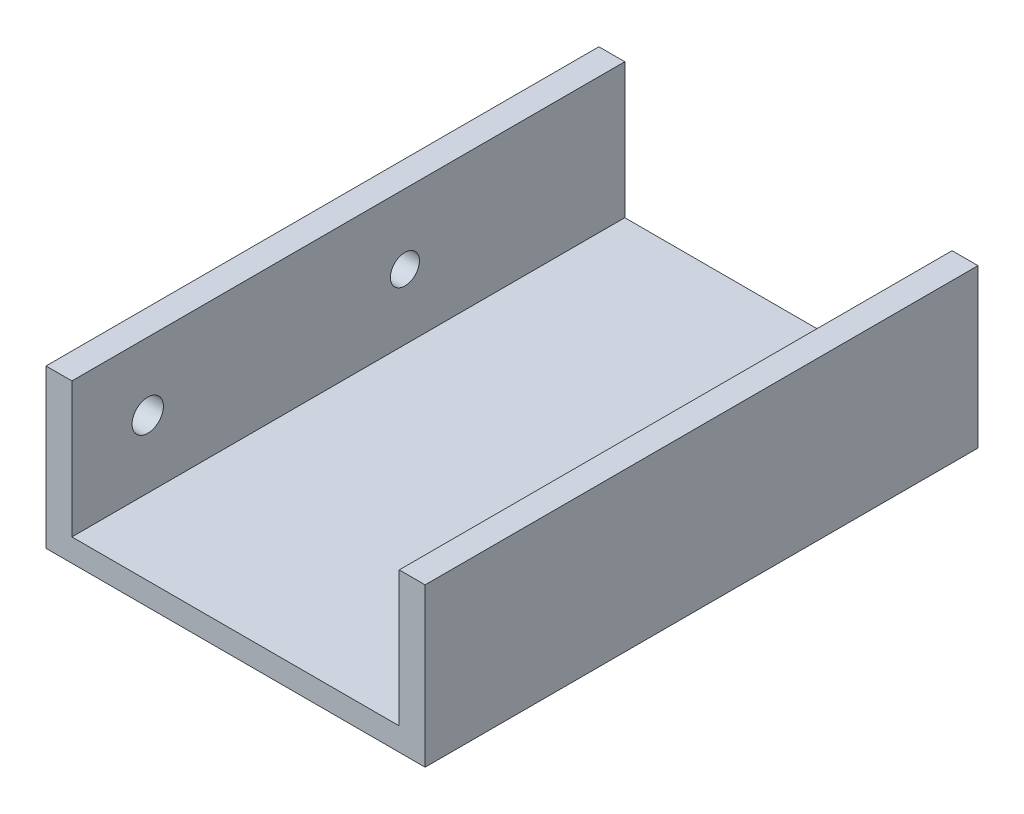
from build123d import *

# Parameters (mm, degrees)
BOSS_EXTRUDE3_DEPTH = 111.125
SKETCH4_R           = 2.921
CUT_EXTRUDE1_DEPTH  = 136.634929771
SKETCH5_R           = 3.145463672
CUT_EXTRUDE2_DEPTH  = 136.634929771


with BuildPart() as part:
    # Sketch2 → Boss-Extrude3 (new body)
    with BuildSketch(Plane.XY):
        Polygon((-38.1, 0), (38.1, 0), (38.1, 31.75), (32.893, 31.75), (32.893, 4.5974), (-32.893, 4.5974), (-32.893, 31.75), (-38.1, 31.75), align=None)
    extrude(amount=BOSS_EXTRUDE3_DEPTH)

    # Sketch4 → Cut-Extrude1 (cut, through all)
    with BuildSketch(Plane(origin=(-32.893, 0, 0), x_dir=(0, 0, -1), z_dir=(1, 0, 0))):
        with Locations((-44.196, 17.735211787)):
            Circle(SKETCH4_R)
    extrude(amount=-CUT_EXTRUDE1_DEPTH, mode=Mode.SUBTRACT)

    # Sketch5 → Cut-Extrude2 (cut, through all)
    with BuildSketch(Plane(origin=(-32.893, 0, 0), x_dir=(0, 0, -1), z_dir=(1, 0, 0))):
        with Locations((-95.885, 18.163390835)):
            Circle(SKETCH5_R)
    extrude(amount=-CUT_EXTRUDE2_DEPTH, mode=Mode.SUBTRACT)


solid = part.part
